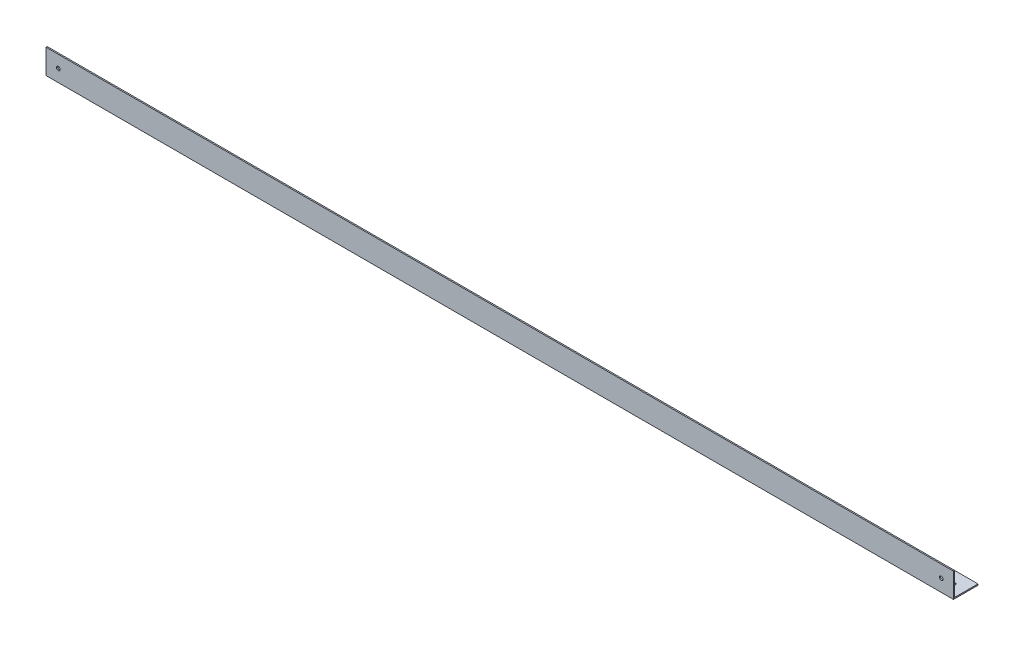
from build123d import *

# Parameters (mm, degrees)
BOSS_EXTRUDE1_DEPTH = 740
CUT_EXTRUDE1_REACH  = 742.54
SKETCH2_R           = 1.5
CUT_EXTRUDE2_REACH  = 742.54
SKETCH3_R           = 1.5


with BuildPart() as part:
    # Sketch1 → Boss-Extrude1 (new body)
    with BuildSketch(Plane(origin=(0, 0, 0), x_dir=(0, 0, -1), z_dir=(1, 0, 0))):
        Polygon((0, 0), (0, 20), (1, 20), (1, 1), (20, 1), (20, 0), align=None)
    extrude(amount=BOSS_EXTRUDE1_DEPTH)

    # Sketch2 → Cut-Extrude1 (cut, up to next)
    with BuildSketch(Plane.XY, mode=Mode.PRIVATE) as cut_extrude1_sk1:
        with Locations((10, 10)):
            Circle(SKETCH2_R)
    cut_extrude1_tool1 = extrude(cut_extrude1_sk1.sketch, amount=-CUT_EXTRUDE1_REACH, mode=Mode.PRIVATE) & part.part
    # Sketch2 → Cut-Extrude1 (cut, up to next)
    with BuildSketch(Plane.XY, mode=Mode.PRIVATE) as cut_extrude1_sk2:
        with Locations((730, 10)):
            Circle(SKETCH2_R)
    cut_extrude1_tool2 = extrude(cut_extrude1_sk2.sketch, amount=-CUT_EXTRUDE1_REACH, mode=Mode.PRIVATE) & part.part
    add(cut_extrude1_tool1.solids().sort_by_distance((10, 10, 0))[0], mode=Mode.SUBTRACT)
    add(cut_extrude1_tool2.solids().sort_by_distance((730, 10, 0))[0], mode=Mode.SUBTRACT)

    # Sketch3 → Cut-Extrude2 (cut, up to next)
    with BuildSketch(Plane.XZ, mode=Mode.PRIVATE) as cut_extrude2_sk1:
        with Locations(Location((10, -10, 0), (0, 0, 270))):
            Circle(SKETCH3_R)
    cut_extrude2_tool1 = extrude(cut_extrude2_sk1.sketch, amount=-CUT_EXTRUDE2_REACH, mode=Mode.PRIVATE) & part.part
    # Sketch3 → Cut-Extrude2 (cut, up to next)
    with BuildSketch(Plane.XZ, mode=Mode.PRIVATE) as cut_extrude2_sk2:
        with Locations(Location((730, -10, 0), (0, 0, 270))):
            Circle(SKETCH3_R)
    cut_extrude2_tool2 = extrude(cut_extrude2_sk2.sketch, amount=-CUT_EXTRUDE2_REACH, mode=Mode.PRIVATE) & part.part
    add(cut_extrude2_tool1.solids().sort_by_distance((10, 0, -10))[0], mode=Mode.SUBTRACT)
    add(cut_extrude2_tool2.solids().sort_by_distance((730, 0, -10))[0], mode=Mode.SUBTRACT)


solid = part.part
